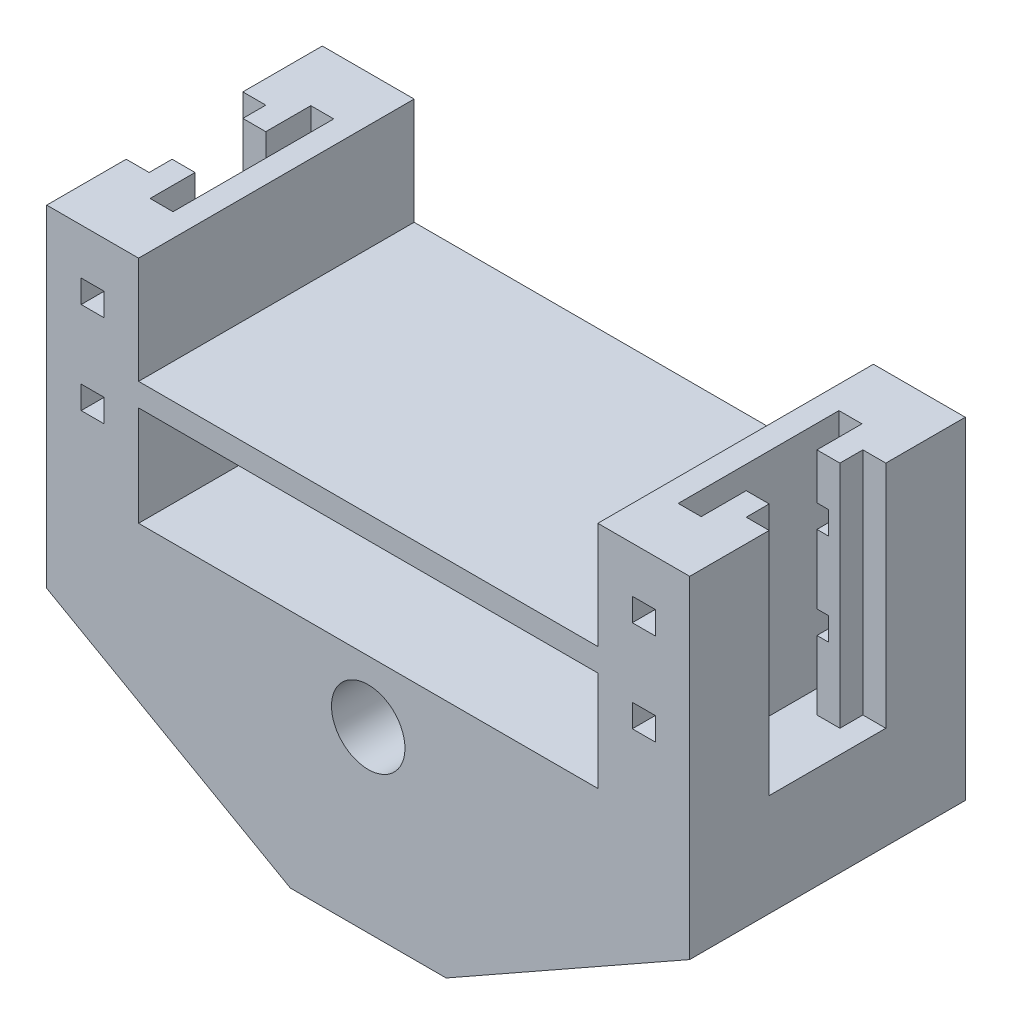
from build123d import *

# Parameters (mm, degrees)
BOSS_EXTRUDE2_DEPTH            = 30
BOSS_EXTRUDE2_DEPTH_BACK       = 30
EXTRUDE_THIN2_DEPTH            = 25
EXTRUDE_THIN2_DEPTH_BACK       = 25
SKETCH2_W                      = 60
SKETCH2_H                      = 5
BOSS_EXTRUDE3_DEPTH            = 100
BOSS_EXTRUDE4_DEPTH            = 30
BOSS_EXTRUDE4_DEPTH_BACK       = 30
CUT_EXTRUDE2_REACH             = 143.361
SKETCH4_W                      = 60
SKETCH4_H                      = 5
CUT_EXTRUDE2_DIRECTION_2_REACH = 143.361
BOSS_EXTRUDE5_DEPTH            = 30
BOSS_EXTRUDE5_DEPTH_BACK       = 30
DRONE_ARM_FIT_CUT_DEPTH        = 50
CUT_EXTRUDE3_START             = -60
SKETCH8_W                      = 5
SKETCH8_H                      = 5
CUT_EXTRUDE3_DEPTH             = 60


with BuildPart() as part:
    # Sketch1 → Boss-Extrude2 (new, two sides: drawn at the far end of the back side and taken through both)
    with BuildSketch(Plane.XY.offset(-BOSS_EXTRUDE2_DEPTH_BACK)):
        Polygon((-13.01396445, -23.830717844), (0, -23.830717844), (0, -18.830717844), (-11.698214449, -18.830717844), (-50, 2.827283512), (-50, 13.432214294), (-55, 13.432214294), (-55, -0.089432632), align=None)
        Polygon((0, -18.830717844), (0, -23.830717844), (13.01396445, -23.830717844), (55, -0.089432632), (55, 13.432214294), (50, 13.432214294), (50, 2.827283512), (11.698214449, -18.830717844), align=None)
        with BuildLine():
            Line((-11.698214449, -18.830717844), (0, -18.830717844))
            Line((0, -18.830717844), (0, -8))
            ThreePointArc((0, -8), (-8, 0), (0, 8))
            Line((0, 8), (0, 13.432214294))
            Line((0, 13.432214294), (-50, 13.432214294))
            Line((-50, 13.432214294), (-50, 2.827283512))
            Line((-50, 2.827283512), (-11.698214449, -18.830717844))
        make_face()
        with BuildLine():
            Line((0, -8), (0, -18.830717844))
            Line((0, -18.830717844), (11.698214449, -18.830717844))
            Line((11.698214449, -18.830717844), (50, 2.827283512))
            Line((50, 2.827283512), (50, 13.432214294))
            Line((50, 13.432214294), (0, 13.432214294))
            Line((0, 13.432214294), (0, 8))
            ThreePointArc((0, 8), (5.656854249, 5.656854249), (8, 0))
            ThreePointArc((8, 0), (5.656854249, -5.656854249), (0, -8))
        make_face()
    extrude(amount=BOSS_EXTRUDE2_DEPTH + BOSS_EXTRUDE2_DEPTH_BACK)

    # Sketch1<5> → Extrude-Thin2 (add, two sides: drawn at the far end of the back side and taken through both)
    with BuildSketch(Plane.XY.offset(-EXTRUDE_THIN2_DEPTH_BACK)):
        Polygon((50, 13.432214294), (50, 38.432214294), (50, 63.432214294), (-50, 63.432214294), (-50, 38.432214294), (-50, 13.432214294), (-55, 13.432214294), (-55, 38.432214294), (-55, 68.432214294), (55, 68.432214294), (55, 38.432214294), (55, 13.432214294), align=None)
    extrude(amount=EXTRUDE_THIN2_DEPTH + EXTRUDE_THIN2_DEPTH_BACK)

    # Sketch2 → Boss-Extrude3 (add)
    with BuildSketch(Plane.ZY.offset(-50)):
        with Locations((0, 37.694873029)):
            Rectangle(SKETCH2_W, SKETCH2_H)
    extrude(amount=BOSS_EXTRUDE3_DEPTH)

    # Sketch1<6> → Boss-Extrude4 (add, two sides: drawn at the far end of the back side and taken through both)
    with BuildSketch(Plane.XY.offset(-BOSS_EXTRUDE4_DEPTH_BACK)):
        Polygon((-55, -0.089432632), (-55, 13.432214294), (-70, 13.432214294), (-70, -8.839581066), (-16.961214453, -38.830717844), (16.961214453, -38.830717844), (70, -8.839581066), (70, 13.432214294), (55, 13.432214294), (55, -0.089432632), (13.01396445, -23.830717844), (-13.01396445, -23.830717844), align=None)
    extrude(amount=BOSS_EXTRUDE4_DEPTH + BOSS_EXTRUDE4_DEPTH_BACK)

    # Cut-Extrude2: up to this face of the body (flat: up to its plane)
    cut_extrude2_end = Plane(part.part.faces().sort_by_distance((-55, 40.932214294, 0))[0])
    # Sketch4 → Cut-Extrude2 (cut, up to the picked face)
    with BuildSketch(Plane(origin=(-50, 0, 0), x_dir=(0, 0, -1), z_dir=(1, 0, 0)), mode=Mode.PRIVATE) as cut_extrude2_sk1:
        with Locations((0, 65.932214294)):
            Rectangle(SKETCH4_W, SKETCH4_H)
    cut_extrude2_tool1 = split(extrude(cut_extrude2_sk1.sketch, amount=-CUT_EXTRUDE2_REACH, mode=Mode.PRIVATE), bisect_by=cut_extrude2_end, keep=Keep.BOTH, mode=Mode.PRIVATE)
    add(cut_extrude2_tool1.solids().sort_by(Axis((-50, 65.932214, 0), (-1, 0, 0)))[0], mode=Mode.SUBTRACT)

    # Cut-Extrude2 direction 2: up to this face of the body (flat: up to its plane)
    cut_extrude2_direction_2_end = Plane(part.part.faces().sort_by_distance((55, 40.932214294, 0))[0])
    # Sketch4 → Cut-Extrude2 direction 2 (cut, up to the picked face)
    with BuildSketch(Plane(origin=(-50, 0, 0), x_dir=(0, 0, -1), z_dir=(1, 0, 0)), mode=Mode.PRIVATE) as cut_extrude2_direction_2_sk1:
        with Locations((0, 65.932214294)):
            Rectangle(SKETCH4_W, SKETCH4_H)
    cut_extrude2_direction_2_tool1 = split(extrude(cut_extrude2_direction_2_sk1.sketch, amount=CUT_EXTRUDE2_DIRECTION_2_REACH, mode=Mode.PRIVATE), bisect_by=cut_extrude2_direction_2_end, keep=Keep.BOTH, mode=Mode.PRIVATE)
    add(cut_extrude2_direction_2_tool1.solids().sort_by(Axis((-50, 65.932214, 0), (1, 0, 0)))[0], mode=Mode.SUBTRACT)

    # Sketch1<7> → Boss-Extrude5 (add, two sides: drawn at the far end of the back side and taken through both)
    with BuildSketch(Plane.XY.offset(-BOSS_EXTRUDE5_DEPTH_BACK)):
        Polygon((-70, 13.432214294), (-55, 13.432214294), (-50, 13.432214294), (-50, 38.432214294), (-50, 63.432214294), (-70, 63.432214294), (-70, 38.432214294), align=None)
        Polygon((50, 38.432214294), (50, 13.432214294), (55, 13.432214294), (70, 13.432214294), (70, 38.432214294), (70, 63.432214294), (50, 63.432214294), align=None)
    extrude(amount=BOSS_EXTRUDE5_DEPTH + BOSS_EXTRUDE5_DEPTH_BACK)

    # Sketch7 → Drone Arm fit cut (cut)
    with BuildSketch(Plane(origin=(0, 63.432214294, 0), x_dir=(1, 0, 0), z_dir=(0, 1, 0))):
        Polygon((-70, -12.7), (-70, 12.7), (-65, 12.7), (-65, 7.7), (-60, 7.7), (-60, 12.7), (-60, 17.5), (-55, 17.5), (-55, -17.5), (-60, -17.5), (-60, -12.7), (-60, -7.7), (-65, -7.7), (-65, -12.7), align=None)
    drone_arm_fit_cut = extrude(amount=-DRONE_ARM_FIT_CUT_DEPTH, mode=Mode.SUBTRACT)

    # Mirror Drone arm fit cut: Drone Arm fit cut across plane
    add(drone_arm_fit_cut.mirror(Plane(origin=(0, 0, 0), x_dir=(0, 0, 1), z_dir=(1, 0, 0))), mode=Mode.SUBTRACT)

    # Sketch8 → Cut-Extrude3 (cut)
    with BuildSketch(Plane.XY.offset(30).offset(CUT_EXTRUDE3_START)):
        with Locations((-60, 50.932214294)):
            Rectangle(SKETCH8_W, SKETCH8_H)
        with Locations((-60, 30.932214294)):
            Rectangle(SKETCH8_W, SKETCH8_H)
    cut_extrude3 = extrude(amount=CUT_EXTRUDE3_DEPTH, mode=Mode.SUBTRACT)

    # Mirror1: Cut-Extrude3 across plane
    add(cut_extrude3.mirror(Plane(origin=(0, 0, 0), x_dir=(0, 0, 1), z_dir=(1, 0, 0))), mode=Mode.SUBTRACT)


solid = part.part
